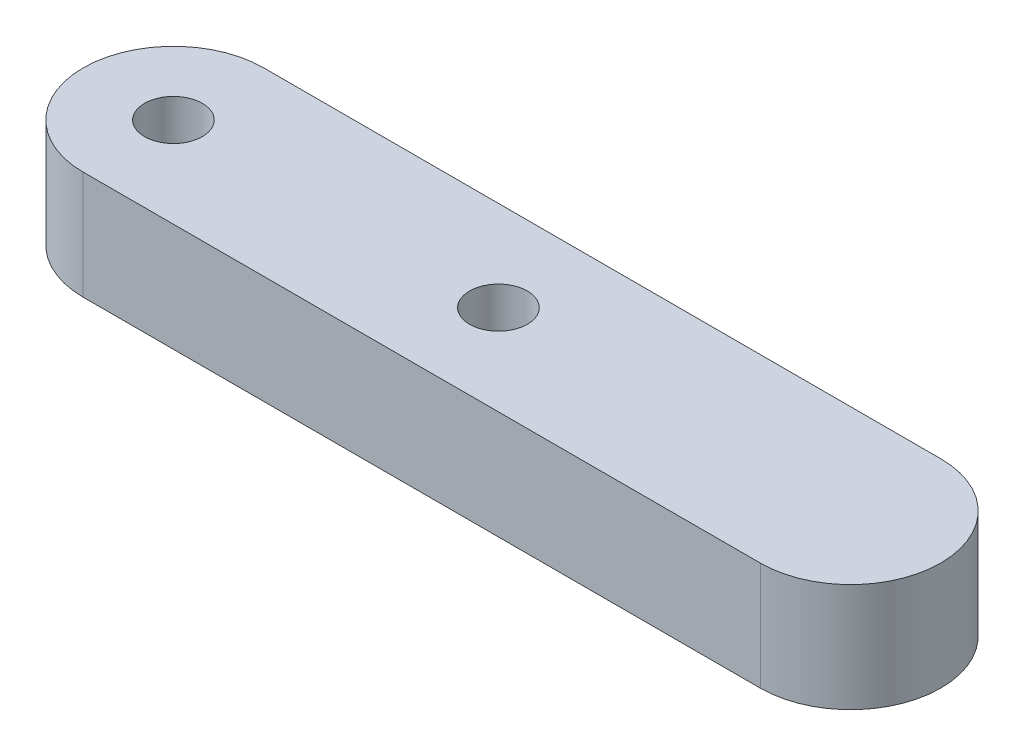
from build123d import *

# Parameters (mm, degrees)
SKETCH1_R           = 1.6
BOSS_EXTRUDE1_DEPTH = 6


with BuildPart() as part:
    # Sketch1 → Boss-Extrude1 (new body)
    with BuildSketch(Plane(origin=(0, 0, 0), x_dir=(1, 0, 0), z_dir=(0, 1, 0))):
        with BuildLine():
            Line((-18.75, 5), (18.75, 5))
            ThreePointArc((18.75, 5), (23.75, 0), (18.75, -5))
            Line((18.75, -5), (-18.75, -5))
            ThreePointArc((-18.75, -5), (-23.75, 0), (-18.75, 5))
        make_face()
        with Locations(Location((-18.75, 0, 0), (0, 0, 270))):
            Circle(SKETCH1_R, mode=Mode.SUBTRACT)
        with Locations(Location((-0.75, 0, 0), (0, 0, 270))):
            Circle(SKETCH1_R, mode=Mode.SUBTRACT)
    extrude(amount=BOSS_EXTRUDE1_DEPTH)


solid = part.part
